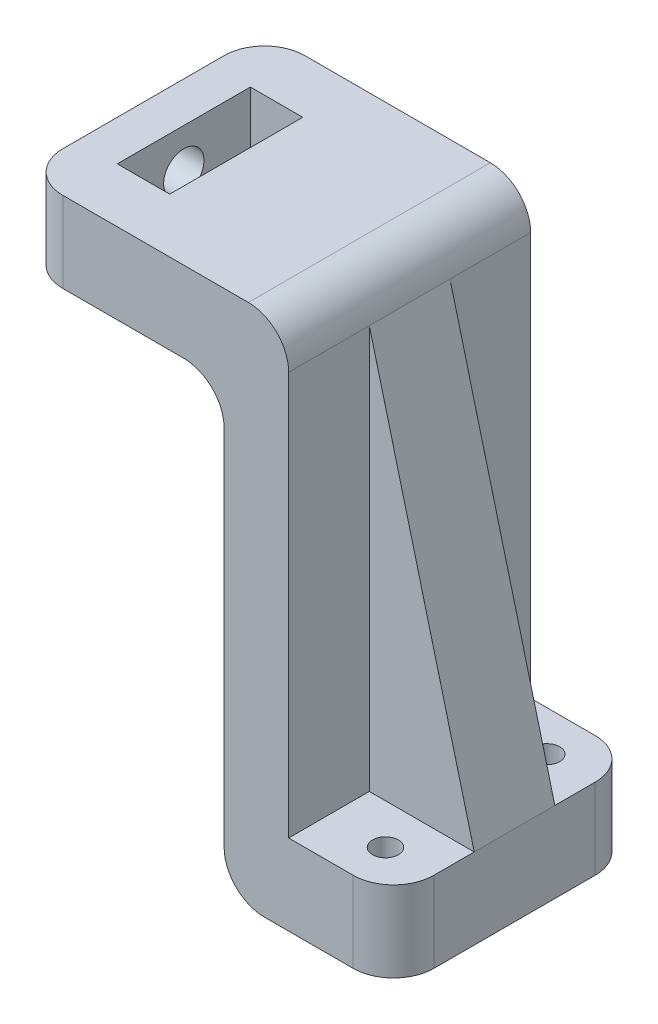
from build123d import *

# Parameters (mm, degrees)
SKETCH1_W           = 21
SKETCH1_H           = 30
SKETCH1_R           = 1.6
BOSS_EXTRUDE3_DEPTH = 10
SKETCH3_W           = 8
SKETCH3_H           = 30
BOSS_EXTRUDE4_DEPTH = 55
SKETCH4_W           = 30
SKETCH4_H           = 10
BOSS_EXTRUDE5_DEPTH = 25
CUT_EXTRUDE1_REACH  = 82.312
SKETCH5_W           = 6.5
SKETCH5_H           = 16.5
SKETCH7_R           = 2.5
CUT_EXTRUDE2_DEPTH  = 17.2
FILLET2_R           = 5
BOSS_EXTRUDE7_START = -10
BOSS_EXTRUDE7_DEPTH = 10


with BuildPart() as part:
    # Sketch1 → Boss-Extrude3 (new body)
    with BuildSketch(Plane(origin=(0, 0, 0), x_dir=(1, 0, 0), z_dir=(0, 1, 0))):
        with Locations((-4.5, -10)):
            Rectangle(SKETCH1_W, SKETCH1_H)
        with Locations(Location((0, 0, 0), (0, 0, 270))):
            Circle(SKETCH1_R, mode=Mode.SUBTRACT)
        with Locations(Location((0, -20, 0), (0, 0, 270))):
            Circle(SKETCH1_R, mode=Mode.SUBTRACT)
    extrude(amount=BOSS_EXTRUDE3_DEPTH)

    # Sketch3 → Boss-Extrude4 (add)
    with BuildSketch(Plane(origin=(0, 10, 0), x_dir=(1, 0, 0), z_dir=(0, 1, 0))):
        with Locations((-11, -10)):
            Rectangle(SKETCH3_W, SKETCH3_H)
    extrude(amount=BOSS_EXTRUDE4_DEPTH)

    # Sketch4 → Boss-Extrude5 (add)
    with BuildSketch(Plane.ZY.offset(15)):
        with Locations((10, 60)):
            Rectangle(SKETCH4_W, SKETCH4_H)
    extrude(amount=BOSS_EXTRUDE5_DEPTH)

    # Sketch5 → Cut-Extrude1 (cut, up to next)
    with BuildSketch(Plane(origin=(0, 65, 0), x_dir=(1, 0, 0), z_dir=(0, 1, 0)), mode=Mode.PRIVATE) as cut_extrude1_sk1:
        with Locations((-31.75, -10)):
            Rectangle(SKETCH5_W, SKETCH5_H)
    cut_extrude1_tool1 = extrude(cut_extrude1_sk1.sketch, amount=-CUT_EXTRUDE1_REACH, mode=Mode.PRIVATE) & part.part
    add(cut_extrude1_tool1.solids().sort_by_distance((-31.75, 65, 10))[0], mode=Mode.SUBTRACT)

    # Sketch7 → Cut-Extrude2 (cut)
    with BuildSketch(Plane.ZY.offset(40)):
        with Locations((10, 60)):
            Circle(SKETCH7_R)
    extrude(amount=-CUT_EXTRUDE2_DEPTH, mode=Mode.SUBTRACT)

    # Fillet2
    fillet2_edges = [part.edges().sort_by_distance(p)[0] for p in [
        (-7, 65, 10),
        (-15, 55, 10),
        (-40, 60, -5),
        (-40, 60, 25),
        (-15, 0, 10),
        (6, 5, -5),
        (6, 5, 25),
    ]]
    fillet(fillet2_edges, radius=FILLET2_R)

    # Sketch8 → Boss-Extrude7 (add)
    with BuildSketch(Plane.XY.offset(25).offset(BOSS_EXTRUDE7_START)):
        Polygon((-7, 10), (-7, 60), (6, 10), align=None)
    extrude(amount=-BOSS_EXTRUDE7_DEPTH)


solid = part.part
